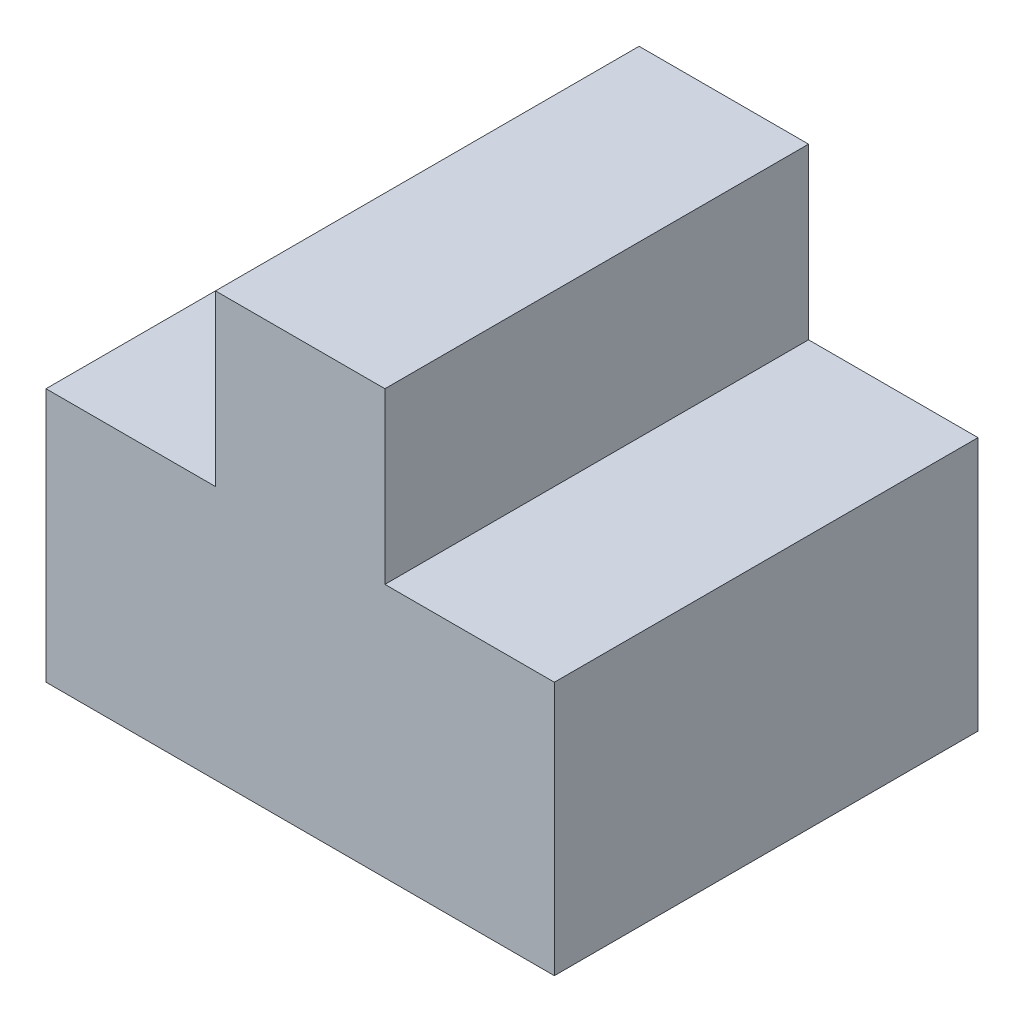
from build123d import *

# Parameters (mm, degrees)
EXTRUSION1_DEPTH = 50


with BuildPart() as part:
    # Esquisse1 → Extrusion1 (new body)
    with BuildSketch(Plane.XY):
        Polygon((0, 0), (60, 0), (60, 30), (40, 30), (40, 50), (20, 50), (20, 30), (0, 30), align=None)
    extrude(amount=EXTRUSION1_DEPTH)


solid = part.part
